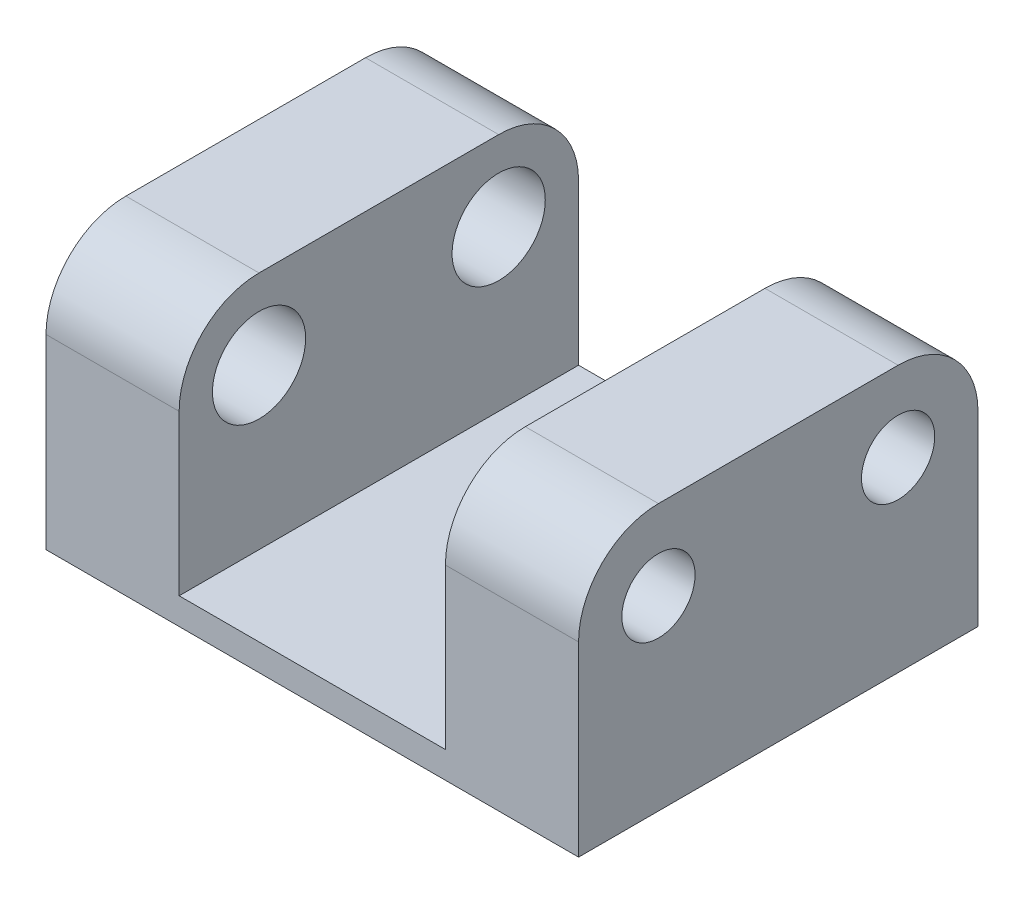
from build123d import *

# Parameters (mm, degrees)
BOSS_EXTRUDE1_DEPTH = 30
FILLET1_R           = 6
SKETCH2_R           = 3.5
CUT_EXTRUDE1_DEPTH  = 30
SKETCH3_R           = 2.75
CUT_EXTRUDE2_DEPTH  = 30


with BuildPart() as part:
    # Sketch1 → Boss-Extrude1 (new body)
    with BuildSketch(Plane.XY):
        Polygon((0, 0), (-20, 0), (-20, 20), (-10, 20), (-10, 2), (10, 2), (10, 20), (20, 20), (20, 0), align=None)
    extrude(amount=BOSS_EXTRUDE1_DEPTH)

    # Fillet1
    fillet1_edges = [part.edges().sort_by_distance(p)[0] for p in [
        (15, 20, 30),
        (15, 20, 0),
        (-15, 20, 30),
        (-15, 20, 0),
    ]]
    fillet(fillet1_edges, radius=FILLET1_R)

    # Sketch2 → Cut-Extrude1 (cut)
    with BuildSketch(Plane(origin=(0, 0, 0), x_dir=(0, 0, -1), z_dir=(1, 0, 0))):
        with Locations((-24, 14)):
            Circle(SKETCH2_R)
        with Locations((-6, 14)):
            Circle(SKETCH2_R)
    extrude(amount=-CUT_EXTRUDE1_DEPTH, mode=Mode.SUBTRACT)

    # Sketch3 → Cut-Extrude2 (cut)
    with BuildSketch(Plane(origin=(0, 0, 0), x_dir=(0, 0, -1), z_dir=(1, 0, 0))):
        with Locations(Location((-6, 14, 0), (0, 0, 90))):
            Circle(SKETCH3_R)
        with Locations(Location((-24, 14, 0), (0, 0, 90))):
            Circle(SKETCH3_R)
    extrude(amount=CUT_EXTRUDE2_DEPTH, mode=Mode.SUBTRACT)


solid = part.part
